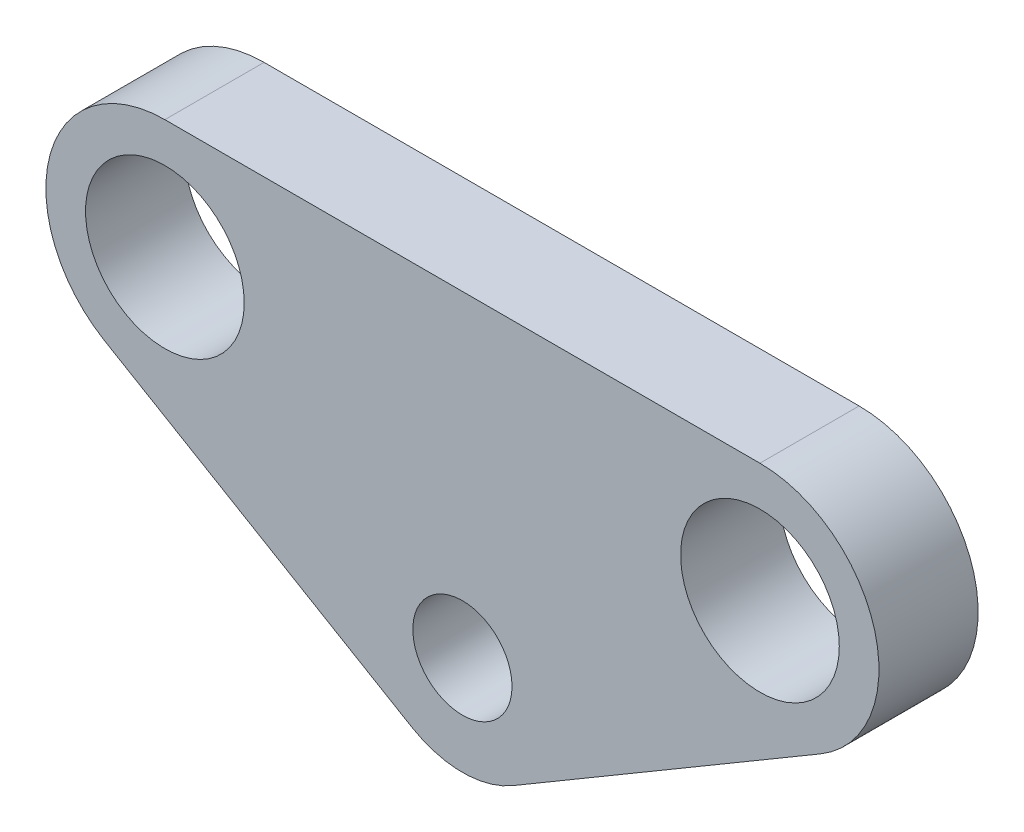
from build123d import *

# Parameters (mm, degrees)
SKETCH1_R           = 2.5
SKETCH1_R_2         = 4
BOSS_EXTRUDE1_DEPTH = 5


with BuildPart() as part:
    # Sketch1 → Boss-Extrude1 (new body)
    with BuildSketch(Plane.XY):
        with BuildLine():
            Line((15, 16), (-15, 16))
            ThreePointArc((-15, 16), (-20.788582927, 11.578704435), (-18.046153846, 4.830769231))
            Line((-18.046153846, 4.830769231), (-2.538461538, -4.307692308))
            ThreePointArc((-2.538461538, -4.307692308), (0, -5), (2.538461538, -4.307692308))
            Line((2.538461538, -4.307692308), (18.046153846, 4.830769231))
            ThreePointArc((18.046153846, 4.830769231), (20.788582927, 11.578704435), (15, 16))
        make_face()
        Circle(SKETCH1_R, mode=Mode.SUBTRACT)
        with Locations((-15, 10)):
            Circle(SKETCH1_R_2, mode=Mode.SUBTRACT)
        with Locations((15, 10)):
            Circle(SKETCH1_R_2, mode=Mode.SUBTRACT)
    extrude(amount=BOSS_EXTRUDE1_DEPTH)


solid = part.part
